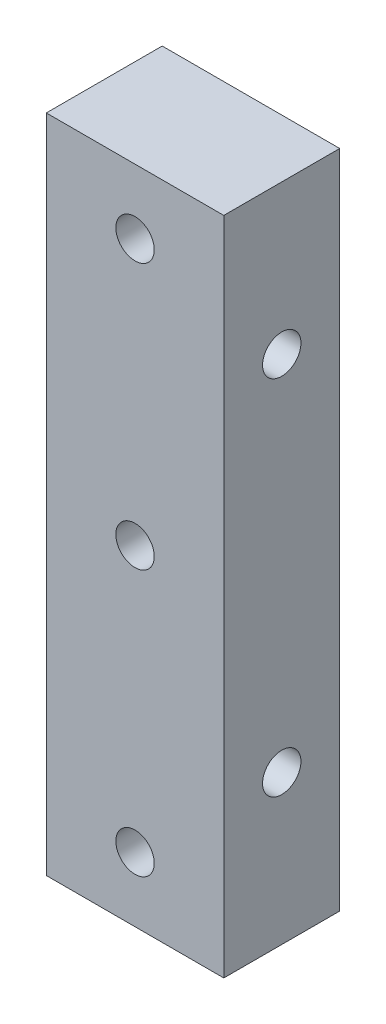
from build123d import *

# Parameters (mm, degrees)
SKETCH1_W                  = 18.669
SKETCH1_H                  = 69.469
BOSS_EXTRUDE1_DEPTH        = 12.192
TAP_DRILL_FOR_10_32_TAP1_D = 4.0386
TAP_DRILL_FOR_10_32_TAP2_D = 4.0386


with BuildPart() as part:
    # Sketch1 → Boss-Extrude1 (new body)
    with BuildSketch(Plane.XY):
        Rectangle(SKETCH1_W, SKETCH1_H)
    extrude(amount=BOSS_EXTRUDE1_DEPTH)

    # Tap Drill for #10-32 Tap1 (through all)
    with Locations(Plane(origin=(9.3345, 0, 0), x_dir=(0, 0, -1), z_dir=(1, 0, 0))):
        with Locations((-6.096, 19.05), (-6.096, -19.05)):
            Hole(TAP_DRILL_FOR_10_32_TAP1_D / 2)

    # Tap Drill for #10-32 Tap2 (through all)
    with Locations(Plane.XY.offset(12.192)):
        with Locations((0, 27.94), (0, -27.94), (0, 0)):
            Hole(TAP_DRILL_FOR_10_32_TAP2_D / 2)


solid = part.part
